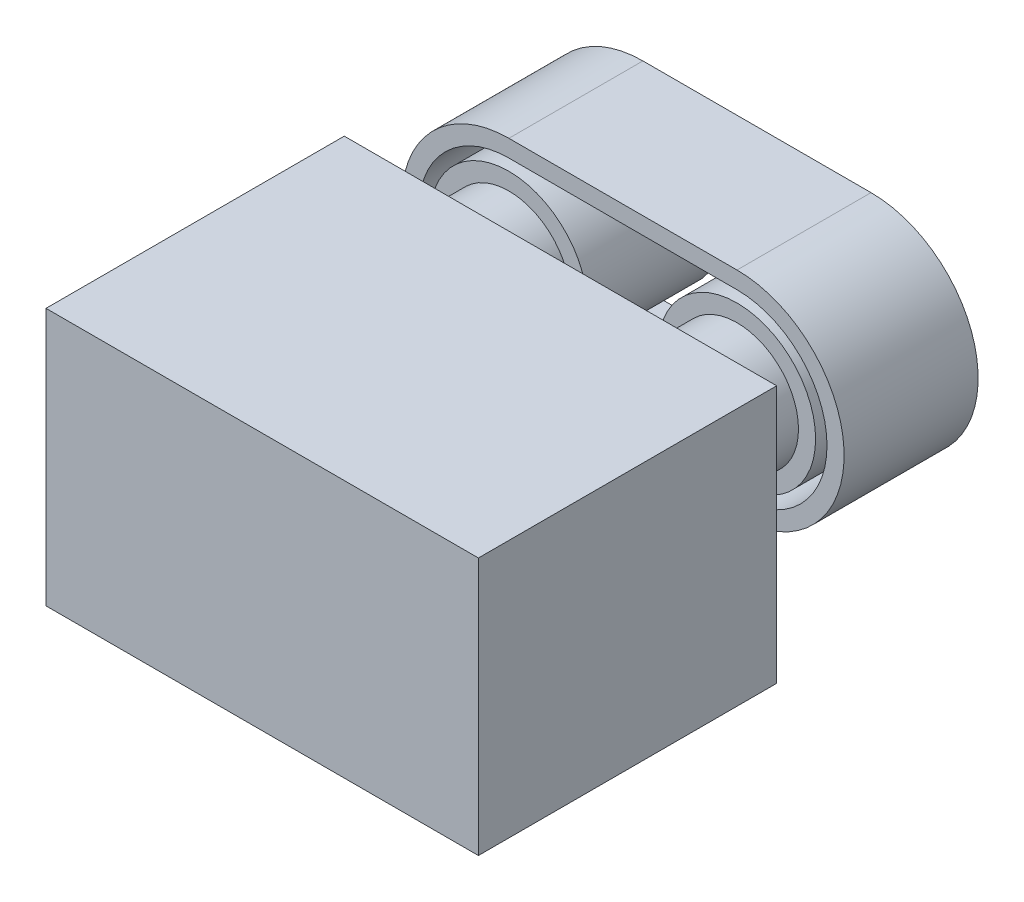
from build123d import *

# Parameters (mm, degrees)
SKETCH_1_R          = 35
EXTRUDE_1_DEPTH     = 59.69
EXTRUDE_1_2_DEPTH   = 59.69
EXTRUDE_1_3_DEPTH   = 59.69
EXTRUDE_2_DEPTH     = 29.845
SKETCH_3_R          = 27.38
EXTRUDE_3_DEPTH     = 20.32
EXTRUDE_4_DEPTH     = 132.842
SKETCH_5_R          = 35
CUT_EXTRUDE_1_DEPTH = 80.01
SKETCH_6_W          = 119.203563449
SKETCH_6_H          = 165.430142189
CUT_EXTRUDE_2_DEPTH = 171.704


with BuildPart() as part:
    # 草图1 → 凸台-拉伸1 (new body)
    with BuildSketch(Plane.XY):
        with Locations(Location((-73.619052145, 0, 0), (0, 0, 180))):
            Circle(SKETCH_1_R)
    extrude(amount=EXTRUDE_1_DEPTH)



with BuildPart() as body_2:
    # 草图1 → Extrude 1 2 (new body)
    with BuildSketch(Plane.XY):
        with Locations(Location((27.980947855, 0, 0), (0, 0, 180))):
            Circle(SKETCH_1_R)
    extrude(amount=EXTRUDE_1_2_DEPTH)


with BuildPart() as body_3:
    # 草图1 → Extrude 1 3 (new body)
    with BuildSketch(Plane.XY):
        with Locations(Location((129.580947855, 0, 0), (0, 0, 180))):
            Circle(SKETCH_1_R)
    extrude(amount=EXTRUDE_1_3_DEPTH)


with BuildPart() as body_4:
    # 草图2 → 凸台-拉伸2 (new, symmetric)
    with BuildSketch(Plane.XY.offset(29.845)):
        with BuildLine():
            Line((27.980947855, 47.7), (129.580947855, 47.7))
            ThreePointArc((129.580947855, 47.7), (177.280947855, 0), (129.580947855, -47.7))
            Line((129.580947855, -47.7), (27.980947855, -47.7))
            ThreePointArc((27.980947855, -47.7), (-19.719052145, 0), (27.980947855, 47.7))
        make_face()
        with BuildLine():
            Line((27.980947855, 40.08), (129.580947855, 40.08))
            ThreePointArc((129.580947855, 40.08), (169.660947855, 0), (129.580947855, -40.08))
            Line((129.580947855, -40.08), (27.980947855, -40.08))
            ThreePointArc((27.980947855, -40.08), (-12.099052145, 0), (27.980947855, 40.08))
        make_face(mode=Mode.SUBTRACT)
    extrude(amount=EXTRUDE_2_DEPTH, both=True)


with BuildPart() as part_1:
    add(part.part)

    add(body_2.part)  # 凸台-拉伸3 merges body 2

    add(body_3.part)  # 凸台-拉伸3 merges body 3
    # 草图3 → 凸台-拉伸3 (add)
    with BuildSketch(Plane.XY.offset(59.69)):
        with Locations((129.580947855, 0)):
            Circle(SKETCH_3_R)
        with Locations((-73.619052145, 0)):
            Circle(SKETCH_3_R)
        with Locations((27.980947855, 0)):
            Circle(SKETCH_3_R)
    extrude(amount=EXTRUDE_3_DEPTH)

    # 草图4 → 凸台-拉伸4 (add)
    with BuildSketch(Plane.XY.offset(80.01)):
        Polygon((-112.093411713, 0), (-112.093411713, -82.567600022), (167.571039974, -82.567600022), (167.571039974, 0), (167.571039974, 32.203785346), (-112.093411713, 32.203785346), align=None)
    extrude(amount=EXTRUDE_4_DEPTH)

    # 草图5 → 切除-拉伸1 (cut)
    with BuildSketch(Plane(origin=(0, 0, 0), x_dir=(-1, 0, 0), z_dir=(0, 0, -1))):
        with Locations((73.619052145, 0)):
            Circle(SKETCH_5_R)
    extrude(amount=-CUT_EXTRUDE_1_DEPTH, mode=Mode.SUBTRACT)

    # 草图6 → 切除-拉伸2 (cut)
    with BuildSketch(Plane(origin=(0, 0, 80.01), x_dir=(-1, 0, 0), z_dir=(0, 0, -1))):
        with Locations((84.615247565, -29.518413235)):
            Rectangle(SKETCH_6_W, SKETCH_6_H)
    extrude(amount=-CUT_EXTRUDE_2_DEPTH, mode=Mode.SUBTRACT)


solid = Compound([body_4.part, part_1.part])
